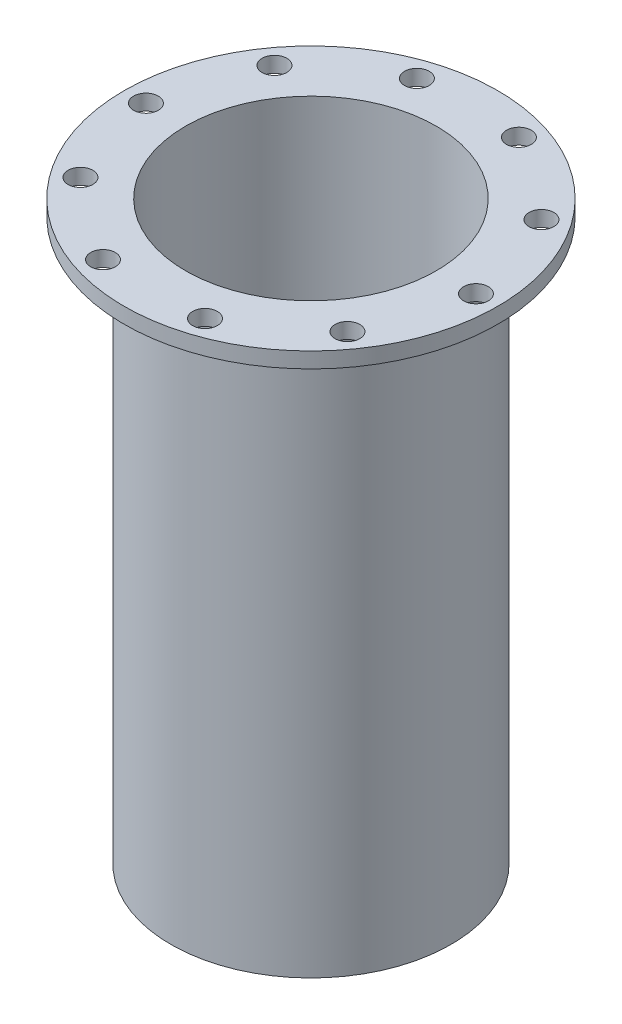
from build123d import *

# Parameters (mm, degrees)
TAP_DRILL_FOR_3_8_16_TAP1_D = 10.0838
CIRPATTERN1_COUNT           = 10


with BuildPart() as part:
    # Sketch1 → Revolve1 (revolve)
    with BuildSketch(Plane.XY, mode=Mode.PRIVATE) as revolve1_sk:
        Polygon((51.1302, 0), (51.1302, -220.345), (53.6702, -220.345), (53.6702, -223.393), (51.1302, -223.393), (51.1302, -234.95), (57.15, -234.95), (57.15, -6.35), (76.2, -6.35), (76.2, 0), align=None)
    revolve(revolve1_sk.sketch.rotate(Axis((0, 0, 0), (0, -1, 0)), 180), axis=Axis((0, 0, 0), (0, -1, 0)))

    # Tap Drill for 3/8-16 Tap1 (through all)
    with Locations(Plane(origin=(0, 0, 0), x_dir=(1, 0, 0), z_dir=(0, 1, 0))):
        with Locations((67.31, 0)):
            tap_drill_for_3_8_16_tap1 = Hole(TAP_DRILL_FOR_3_8_16_TAP1_D / 2)

    # CirPattern1: Tap Drill for 3/8-16 Tap1 ×10 about axis
    cirpattern1_axis = Axis((0, 0, 0), (0, 1, 0))
    for i in range(1, CIRPATTERN1_COUNT):
        add(tap_drill_for_3_8_16_tap1.rotate(cirpattern1_axis, i * 360 / CIRPATTERN1_COUNT), mode=Mode.SUBTRACT)


solid = part.part
